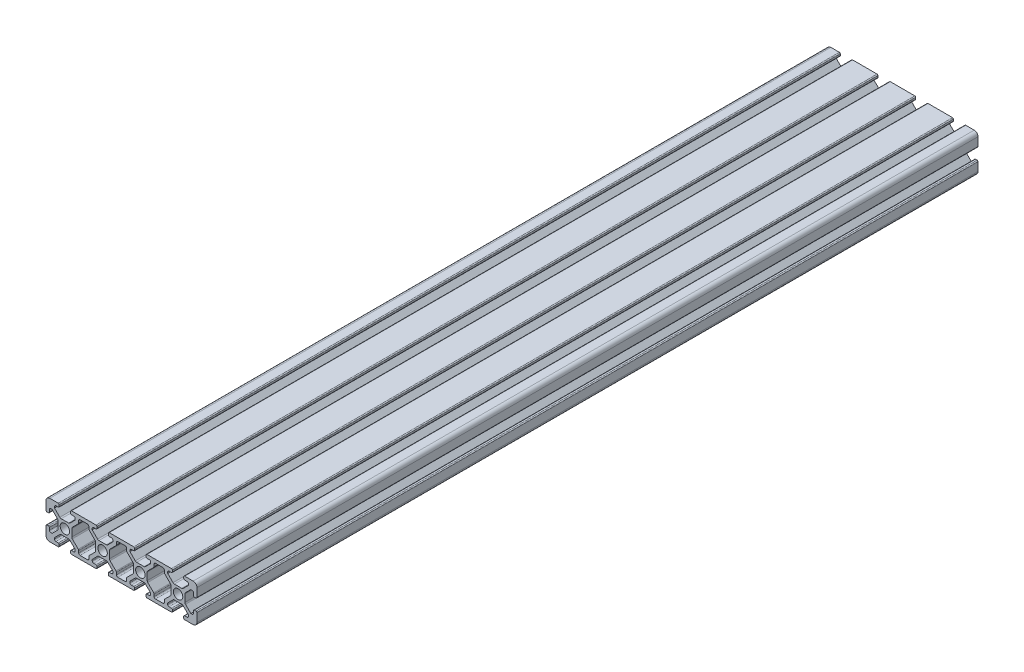
from build123d import *

# Parameters (mm, degrees)
SKETCH1_R           = 2.5
BOSS_EXTRUDE1_DEPTH = 414


with BuildPart() as part:
    # Sketch1 → Boss-Extrude1 (new body)
    with BuildSketch(Plane.XY):
        with BuildLine():
            Line((-41.934956355, 2.341454023), (-37.434956355, 2.341454023))
            ThreePointArc((-37.434956355, 2.341454023), (-37.081402965, 2.487900633), (-36.934956355, 2.841454023))
            Line((-36.934956355, 2.841454023), (-36.934956355, 3.641454023))
            ThreePointArc((-36.934956355, 3.641454023), (-37.081402965, 3.995007414), (-37.434956355, 4.141454023))
            Line((-37.434956355, 4.141454023), (-38.684956355, 4.141454023))
            ThreePointArc((-38.684956355, 4.141454023), (-39.215286441, 4.361123937), (-39.434956355, 4.891454023))
            Line((-39.434956355, 4.891454023), (-39.434956355, 5.568661817))
            Line((-39.434956355, 5.568661817), (-36.605057368, 8.398560804))
            ThreePointArc((-36.605057368, 8.398560804), (-36.280634019, 8.615333556), (-35.897950587, 8.691454023))
            Line((-35.897950587, 8.691454023), (-31.971962124, 8.691454023))
            ThreePointArc((-31.971962124, 8.691454023), (-31.589278691, 8.615333556), (-31.264855343, 8.398560804))
            Line((-31.264855343, 8.398560804), (-28.434956355, 5.568661817))
            Line((-28.434956355, 5.568661817), (-28.434956355, 4.891454023))
            ThreePointArc((-28.434956355, 4.891454023), (-28.654626269, 4.361123937), (-29.184956355, 4.141454023))
            Line((-29.184956355, 4.141454023), (-30.434956355, 4.141454023))
            ThreePointArc((-30.434956355, 4.141454023), (-30.788509746, 3.995007414), (-30.934956355, 3.641454023))
            Line((-30.934956355, 3.641454023), (-30.934956355, 2.841454023))
            ThreePointArc((-30.934956355, 2.841454023), (-30.788509746, 2.487900633), (-30.434956355, 2.341454023))
            Line((-30.434956355, 2.341454023), (-17.434956355, 2.341454023))
            ThreePointArc((-17.434956355, 2.341454023), (-17.081402965, 2.487900633), (-16.934956355, 2.841454023))
            Line((-16.934956355, 2.841454023), (-16.934956355, 3.641454023))
            ThreePointArc((-16.934956355, 3.641454023), (-17.081402965, 3.995007414), (-17.434956355, 4.141454023))
            Line((-17.434956355, 4.141454023), (-18.684956355, 4.141454023))
            ThreePointArc((-18.684956355, 4.141454023), (-19.215286441, 4.361123937), (-19.434956355, 4.891454023))
            Line((-19.434956355, 4.891454023), (-19.434956355, 5.568661817))
            Line((-19.434956355, 5.568661817), (-16.605057368, 8.398560804))
            ThreePointArc((-16.605057368, 8.398560804), (-16.280634019, 8.615333556), (-15.897950587, 8.691454023))
            Line((-15.897950587, 8.691454023), (-11.971962124, 8.691454023))
            ThreePointArc((-11.971962124, 8.691454023), (-11.589278691, 8.615333556), (-11.264855343, 8.398560804))
            Line((-11.264855343, 8.398560804), (-8.434956355, 5.568661817))
            Line((-8.434956355, 5.568661817), (-8.434956355, 4.891454023))
            ThreePointArc((-8.434956355, 4.891454023), (-8.654626269, 4.361123937), (-9.184956355, 4.141454023))
            Line((-9.184956355, 4.141454023), (-10.434956355, 4.141454023))
            ThreePointArc((-10.434956355, 4.141454023), (-10.788509746, 3.995007414), (-10.934956355, 3.641454023))
            Line((-10.934956355, 3.641454023), (-10.934956355, 2.841454023))
            ThreePointArc((-10.934956355, 2.841454023), (-10.788509746, 2.487900633), (-10.434956355, 2.341454023))
            Line((-10.434956355, 2.341454023), (2.565043645, 2.341454023))
            ThreePointArc((2.565043645, 2.341454023), (2.918597035, 2.487900633), (3.065043645, 2.841454023))
            Line((3.065043645, 2.841454023), (3.065043645, 3.641454023))
            ThreePointArc((3.065043645, 3.641454023), (2.918597035, 3.995007414), (2.565043645, 4.141454023))
            Line((2.565043645, 4.141454023), (1.315043645, 4.141454023))
            ThreePointArc((1.315043645, 4.141454023), (0.784713559, 4.361123937), (0.565043645, 4.891454023))
            Line((0.565043645, 4.891454023), (0.565043645, 5.568661817))
            Line((0.565043645, 5.568661817), (3.394942632, 8.398560804))
            ThreePointArc((3.394942632, 8.398560804), (3.719365981, 8.615333556), (4.102049413, 8.691454023))
            Line((4.102049413, 8.691454023), (8.028037876, 8.691454023))
            ThreePointArc((8.028037876, 8.691454023), (8.410721309, 8.615333556), (8.735144657, 8.398560804))
            Line((8.735144657, 8.398560804), (11.565043645, 5.568661817))
            Line((11.565043645, 5.568661817), (11.565043645, 4.891454023))
            ThreePointArc((11.565043645, 4.891454023), (11.345373731, 4.361123937), (10.815043645, 4.141454023))
            Line((10.815043645, 4.141454023), (9.565043645, 4.141454023))
            ThreePointArc((9.565043645, 4.141454023), (9.211490254, 3.995007414), (9.065043645, 3.641454023))
            Line((9.065043645, 3.641454023), (9.065043645, 2.841454023))
            ThreePointArc((9.065043645, 2.841454023), (9.211490254, 2.487900633), (9.565043645, 2.341454023))
            Line((9.565043645, 2.341454023), (22.565043645, 2.341454023))
            ThreePointArc((22.565043645, 2.341454023), (22.918597035, 2.487900633), (23.065043645, 2.841454023))
            Line((23.065043645, 2.841454023), (23.065043645, 3.641454023))
            ThreePointArc((23.065043645, 3.641454023), (22.918597035, 3.995007414), (22.565043645, 4.141454023))
            Line((22.565043645, 4.141454023), (21.315043645, 4.141454023))
            ThreePointArc((21.315043645, 4.141454023), (20.784713559, 4.361123937), (20.565043645, 4.891454023))
            Line((20.565043645, 4.891454023), (20.565043645, 5.568661817))
            Line((20.565043645, 5.568661817), (23.394942632, 8.398560804))
            ThreePointArc((23.394942632, 8.398560804), (23.719365981, 8.615333556), (24.102049413, 8.691454023))
            Line((24.102049413, 8.691454023), (28.028037876, 8.691454023))
            ThreePointArc((28.028037876, 8.691454023), (28.410721309, 8.615333556), (28.735144657, 8.398560804))
            Line((28.735144657, 8.398560804), (31.565043645, 5.568661817))
            Line((31.565043645, 5.568661817), (31.565043645, 4.891454023))
            ThreePointArc((31.565043645, 4.891454023), (31.345373731, 4.361123937), (30.815043645, 4.141454023))
            Line((30.815043645, 4.141454023), (29.565043645, 4.141454023))
            ThreePointArc((29.565043645, 4.141454023), (29.211490254, 3.995007414), (29.065043645, 3.641454023))
            Line((29.065043645, 3.641454023), (29.065043645, 2.841454023))
            ThreePointArc((29.065043645, 2.841454023), (29.211490254, 2.487900633), (29.565043645, 2.341454023))
            Line((29.565043645, 2.341454023), (34.065043645, 2.341454023))
            ThreePointArc((34.065043645, 2.341454023), (35.479257207, 2.927240461), (36.065043645, 4.341454023))
            Line((36.065043645, 4.341454023), (36.065043645, 8.841454023))
            ThreePointArc((36.065043645, 8.841454023), (35.918597035, 9.195007414), (35.565043645, 9.341454023))
            Line((35.565043645, 9.341454023), (34.765043645, 9.341454023))
            ThreePointArc((34.765043645, 9.341454023), (34.411490254, 9.195007414), (34.265043645, 8.841454023))
            Line((34.265043645, 8.841454023), (34.265043645, 7.591454023))
            ThreePointArc((34.265043645, 7.591454023), (34.045373731, 7.061123937), (33.515043645, 6.841454023))
            Line((33.515043645, 6.841454023), (32.837835851, 6.841454023))
            Line((32.837835851, 6.841454023), (30.007936864, 9.671353011))
            ThreePointArc((30.007936864, 9.671353011), (29.791164112, 9.995776359), (29.715043645, 10.378459792))
            Line((29.715043645, 10.378459792), (29.715043645, 14.304448255))
            ThreePointArc((29.715043645, 14.304448255), (29.791164112, 14.687131687), (30.007936864, 15.011555036))
            Line((30.007936864, 15.011555036), (32.837835851, 17.841454023))
            Line((32.837835851, 17.841454023), (33.515043645, 17.841454023))
            ThreePointArc((33.515043645, 17.841454023), (34.045373731, 17.621784109), (34.265043645, 17.091454023))
            Line((34.265043645, 17.091454023), (34.265043645, 15.841454023))
            ThreePointArc((34.265043645, 15.841454023), (34.411490254, 15.487900633), (34.765043645, 15.341454023))
            Line((34.765043645, 15.341454023), (35.565043645, 15.341454023))
            ThreePointArc((35.565043645, 15.341454023), (35.918597035, 15.487900633), (36.065043645, 15.841454023))
            Line((36.065043645, 15.841454023), (36.065043645, 20.341454023))
            ThreePointArc((36.065043645, 20.341454023), (35.479257207, 21.755667586), (34.065043645, 22.341454023))
            Line((34.065043645, 22.341454023), (29.565043645, 22.341454023))
            ThreePointArc((29.565043645, 22.341454023), (29.211490254, 22.195007414), (29.065043645, 21.841454023))
            Line((29.065043645, 21.841454023), (29.065043645, 21.041454023))
            ThreePointArc((29.065043645, 21.041454023), (29.211490254, 20.687900633), (29.565043645, 20.541454023))
            Line((29.565043645, 20.541454023), (30.815043645, 20.541454023))
            ThreePointArc((30.815043645, 20.541454023), (31.345373731, 20.321784109), (31.565043645, 19.791454023))
            Line((31.565043645, 19.791454023), (31.565043645, 19.114246229))
            Line((31.565043645, 19.114246229), (28.735144657, 16.284347242))
            ThreePointArc((28.735144657, 16.284347242), (28.410721309, 16.067574491), (28.028037876, 15.991454023))
            Line((28.028037876, 15.991454023), (24.102049413, 15.991454023))
            ThreePointArc((24.102049413, 15.991454023), (23.719365981, 16.067574491), (23.394942632, 16.284347242))
            Line((23.394942632, 16.284347242), (20.565043645, 19.114246229))
            Line((20.565043645, 19.114246229), (20.565043645, 19.791454023))
            ThreePointArc((20.565043645, 19.791454023), (20.784713559, 20.321784109), (21.315043645, 20.541454023))
            Line((21.315043645, 20.541454023), (22.565043645, 20.541454023))
            ThreePointArc((22.565043645, 20.541454023), (22.918597035, 20.687900633), (23.065043645, 21.041454023))
            Line((23.065043645, 21.041454023), (23.065043645, 21.841454023))
            ThreePointArc((23.065043645, 21.841454023), (22.918597035, 22.195007414), (22.565043645, 22.341454023))
            Line((22.565043645, 22.341454023), (9.565043645, 22.341454023))
            ThreePointArc((9.565043645, 22.341454023), (9.211490254, 22.195007414), (9.065043645, 21.841454023))
            Line((9.065043645, 21.841454023), (9.065043645, 21.041454023))
            ThreePointArc((9.065043645, 21.041454023), (9.211490254, 20.687900633), (9.565043645, 20.541454023))
            Line((9.565043645, 20.541454023), (10.815043645, 20.541454023))
            ThreePointArc((10.815043645, 20.541454023), (11.345373731, 20.321784109), (11.565043645, 19.791454023))
            Line((11.565043645, 19.791454023), (11.565043645, 19.114246229))
            Line((11.565043645, 19.114246229), (8.735144657, 16.284347242))
            ThreePointArc((8.735144657, 16.284347242), (8.410721309, 16.067574491), (8.028037876, 15.991454023))
            Line((8.028037876, 15.991454023), (4.102049413, 15.991454023))
            ThreePointArc((4.102049413, 15.991454023), (3.719365981, 16.067574491), (3.394942632, 16.284347242))
            Line((3.394942632, 16.284347242), (0.565043645, 19.114246229))
            Line((0.565043645, 19.114246229), (0.565043645, 19.791454023))
            ThreePointArc((0.565043645, 19.791454023), (0.784713559, 20.321784109), (1.315043645, 20.541454023))
            Line((1.315043645, 20.541454023), (2.565043645, 20.541454023))
            ThreePointArc((2.565043645, 20.541454023), (2.918597035, 20.687900633), (3.065043645, 21.041454023))
            Line((3.065043645, 21.041454023), (3.065043645, 21.841454023))
            ThreePointArc((3.065043645, 21.841454023), (2.918597035, 22.195007414), (2.565043645, 22.341454023))
            Line((2.565043645, 22.341454023), (-10.434956355, 22.341454023))
            ThreePointArc((-10.434956355, 22.341454023), (-10.788509746, 22.195007414), (-10.934956355, 21.841454023))
            Line((-10.934956355, 21.841454023), (-10.934956355, 21.041454023))
            ThreePointArc((-10.934956355, 21.041454023), (-10.788509746, 20.687900633), (-10.434956355, 20.541454023))
            Line((-10.434956355, 20.541454023), (-9.184956355, 20.541454023))
            ThreePointArc((-9.184956355, 20.541454023), (-8.654626269, 20.321784109), (-8.434956355, 19.791454023))
            Line((-8.434956355, 19.791454023), (-8.434956355, 19.114246229))
            Line((-8.434956355, 19.114246229), (-11.264855343, 16.284347242))
            ThreePointArc((-11.264855343, 16.284347242), (-11.589278691, 16.067574491), (-11.971962124, 15.991454023))
            Line((-11.971962124, 15.991454023), (-15.897950587, 15.991454023))
            ThreePointArc((-15.897950587, 15.991454023), (-16.280634019, 16.067574491), (-16.605057368, 16.284347242))
            Line((-16.605057368, 16.284347242), (-19.434956355, 19.114246229))
            Line((-19.434956355, 19.114246229), (-19.434956355, 19.791454023))
            ThreePointArc((-19.434956355, 19.791454023), (-19.215286441, 20.321784109), (-18.684956355, 20.541454023))
            Line((-18.684956355, 20.541454023), (-17.434956355, 20.541454023))
            ThreePointArc((-17.434956355, 20.541454023), (-17.081402965, 20.687900633), (-16.934956355, 21.041454023))
            Line((-16.934956355, 21.041454023), (-16.934956355, 21.841454023))
            ThreePointArc((-16.934956355, 21.841454023), (-17.081402965, 22.195007414), (-17.434956355, 22.341454023))
            Line((-17.434956355, 22.341454023), (-30.434956355, 22.341454023))
            ThreePointArc((-30.434956355, 22.341454023), (-30.788509746, 22.195007414), (-30.934956355, 21.841454023))
            Line((-30.934956355, 21.841454023), (-30.934956355, 21.041454023))
            ThreePointArc((-30.934956355, 21.041454023), (-30.788509746, 20.687900633), (-30.434956355, 20.541454023))
            Line((-30.434956355, 20.541454023), (-29.184956355, 20.541454023))
            ThreePointArc((-29.184956355, 20.541454023), (-28.654626269, 20.321784109), (-28.434956355, 19.791454023))
            Line((-28.434956355, 19.791454023), (-28.434956355, 19.114246229))
            Line((-28.434956355, 19.114246229), (-31.264855343, 16.284347242))
            ThreePointArc((-31.264855343, 16.284347242), (-31.589278691, 16.067574491), (-31.971962124, 15.991454023))
            Line((-31.971962124, 15.991454023), (-35.897950587, 15.991454023))
            ThreePointArc((-35.897950587, 15.991454023), (-36.280634019, 16.067574491), (-36.605057368, 16.284347242))
            Line((-36.605057368, 16.284347242), (-39.434956355, 19.114246229))
            Line((-39.434956355, 19.114246229), (-39.434956355, 19.791454023))
            ThreePointArc((-39.434956355, 19.791454023), (-39.215286441, 20.321784109), (-38.684956355, 20.541454023))
            Line((-38.684956355, 20.541454023), (-37.434956355, 20.541454023))
            ThreePointArc((-37.434956355, 20.541454023), (-37.081402965, 20.687900633), (-36.934956355, 21.041454023))
            Line((-36.934956355, 21.041454023), (-36.934956355, 21.841454023))
            ThreePointArc((-36.934956355, 21.841454023), (-37.081402965, 22.195007414), (-37.434956355, 22.341454023))
            Line((-37.434956355, 22.341454023), (-41.934956355, 22.341454023))
            ThreePointArc((-41.934956355, 22.341454023), (-43.349169918, 21.755667586), (-43.934956355, 20.341454023))
            Line((-43.934956355, 20.341454023), (-43.934956355, 15.841454023))
            ThreePointArc((-43.934956355, 15.841454023), (-43.788509746, 15.487900633), (-43.434956355, 15.341454023))
            Line((-43.434956355, 15.341454023), (-42.634956355, 15.341454023))
            ThreePointArc((-42.634956355, 15.341454023), (-42.281402965, 15.487900633), (-42.134956355, 15.841454023))
            Line((-42.134956355, 15.841454023), (-42.134956355, 17.091454023))
            ThreePointArc((-42.134956355, 17.091454023), (-41.915286441, 17.621784109), (-41.384956355, 17.841454023))
            Line((-41.384956355, 17.841454023), (-40.707748561, 17.841454023))
            Line((-40.707748561, 17.841454023), (-37.877849574, 15.011555036))
            ThreePointArc((-37.877849574, 15.011555036), (-37.661076823, 14.687131687), (-37.584956355, 14.304448255))
            Line((-37.584956355, 14.304448255), (-37.584956355, 10.378459792))
            ThreePointArc((-37.584956355, 10.378459792), (-37.661076823, 9.995776359), (-37.877849574, 9.671353011))
            Line((-37.877849574, 9.671353011), (-40.707748561, 6.841454023))
            Line((-40.707748561, 6.841454023), (-41.384956355, 6.841454023))
            ThreePointArc((-41.384956355, 6.841454023), (-41.915286441, 7.061123937), (-42.134956355, 7.591454023))
            Line((-42.134956355, 7.591454023), (-42.134956355, 8.841454023))
            ThreePointArc((-42.134956355, 8.841454023), (-42.281402965, 9.195007414), (-42.634956355, 9.341454023))
            Line((-42.634956355, 9.341454023), (-43.434956355, 9.341454023))
            ThreePointArc((-43.434956355, 9.341454023), (-43.788509746, 9.195007414), (-43.934956355, 8.841454023))
            Line((-43.934956355, 8.841454023), (-43.934956355, 4.341454023))
            ThreePointArc((-43.934956355, 4.341454023), (-43.349169918, 2.927240461), (-41.934956355, 2.341454023))
        make_face()
        with Locations((-33.934956355, 12.341454023)):
            Circle(SKETCH1_R, mode=Mode.SUBTRACT)
        with Locations((-13.934956355, 12.341454023)):
            Circle(SKETCH1_R, mode=Mode.SUBTRACT)
        with Locations((6.065043645, 12.341454023)):
            Circle(SKETCH1_R, mode=Mode.SUBTRACT)
        with Locations((26.065043645, 12.341454023)):
            Circle(SKETCH1_R, mode=Mode.SUBTRACT)
        with BuildLine():
            Line((-9.992063136, 15.011555036), (-6.854626269, 18.148991903))
            ThreePointArc((-6.854626269, 18.148991903), (-6.692046706, 18.392309415), (-6.634956355, 18.679321989))
            Line((-6.634956355, 18.679321989), (-6.634956355, 19.791454023))
            ThreePointArc((-6.634956355, 19.791454023), (-6.415286441, 20.321784109), (-5.884956355, 20.541454023))
            Line((-5.884956355, 20.541454023), (-1.984956355, 20.541454023))
            ThreePointArc((-1.984956355, 20.541454023), (-1.454626269, 20.321784109), (-1.234956355, 19.791454023))
            Line((-1.234956355, 19.791454023), (-1.234956355, 18.679321989))
            ThreePointArc((-1.234956355, 18.679321989), (-1.177866005, 18.392309415), (-1.015286441, 18.148991903))
            Line((-1.015286441, 18.148991903), (2.122150426, 15.011555036))
            ThreePointArc((2.122150426, 15.011555036), (2.338923177, 14.687131687), (2.415043645, 14.304448255))
            Line((2.415043645, 14.304448255), (2.415043645, 10.378459792))
            ThreePointArc((2.415043645, 10.378459792), (2.338923177, 9.995776359), (2.122150426, 9.671353011))
            Line((2.122150426, 9.671353011), (-1.015286441, 6.533916144))
            ThreePointArc((-1.015286441, 6.533916144), (-1.177866005, 6.290598632), (-1.234956355, 6.003586058))
            Line((-1.234956355, 6.003586058), (-1.234956355, 4.891454023))
            ThreePointArc((-1.234956355, 4.891454023), (-1.454626269, 4.361123937), (-1.984956355, 4.141454023))
            Line((-1.984956355, 4.141454023), (-5.884956355, 4.141454023))
            ThreePointArc((-5.884956355, 4.141454023), (-6.415286441, 4.361123937), (-6.634956355, 4.891454023))
            Line((-6.634956355, 4.891454023), (-6.634956355, 6.003586058))
            ThreePointArc((-6.634956355, 6.003586058), (-6.692046706, 6.290598632), (-6.854626269, 6.533916144))
            Line((-6.854626269, 6.533916144), (-9.992063136, 9.671353011))
            ThreePointArc((-9.992063136, 9.671353011), (-10.208835888, 9.995776359), (-10.284956355, 10.378459792))
            Line((-10.284956355, 10.378459792), (-10.284956355, 14.304448255))
            ThreePointArc((-10.284956355, 14.304448255), (-10.208835888, 14.687131687), (-9.992063136, 15.011555036))
        make_face(mode=Mode.SUBTRACT)
        with BuildLine():
            Line((-21.015286441, 18.148991903), (-17.877849574, 15.011555036))
            ThreePointArc((-17.877849574, 15.011555036), (-17.661076823, 14.687131687), (-17.584956355, 14.304448255))
            Line((-17.584956355, 14.304448255), (-17.584956355, 10.378459792))
            ThreePointArc((-17.584956355, 10.378459792), (-17.661076823, 9.995776359), (-17.877849574, 9.671353011))
            Line((-17.877849574, 9.671353011), (-21.015286441, 6.533916144))
            ThreePointArc((-21.015286441, 6.533916144), (-21.177866005, 6.290598632), (-21.234956355, 6.003586058))
            Line((-21.234956355, 6.003586058), (-21.234956355, 4.891454023))
            ThreePointArc((-21.234956355, 4.891454023), (-21.454626269, 4.361123937), (-21.984956355, 4.141454023))
            Line((-21.984956355, 4.141454023), (-25.884956355, 4.141454023))
            ThreePointArc((-25.884956355, 4.141454023), (-26.415286441, 4.361123937), (-26.634956355, 4.891454023))
            Line((-26.634956355, 4.891454023), (-26.634956355, 6.003586058))
            ThreePointArc((-26.634956355, 6.003586058), (-26.692046706, 6.290598632), (-26.854626269, 6.533916144))
            Line((-26.854626269, 6.533916144), (-29.992063136, 9.671353011))
            ThreePointArc((-29.992063136, 9.671353011), (-30.208835888, 9.995776359), (-30.284956355, 10.378459792))
            Line((-30.284956355, 10.378459792), (-30.284956355, 14.304448255))
            ThreePointArc((-30.284956355, 14.304448255), (-30.208835888, 14.687131687), (-29.992063136, 15.011555036))
            Line((-29.992063136, 15.011555036), (-26.854626269, 18.148991903))
            ThreePointArc((-26.854626269, 18.148991903), (-26.692046706, 18.392309415), (-26.634956355, 18.679321989))
            Line((-26.634956355, 18.679321989), (-26.634956355, 19.791454023))
            ThreePointArc((-26.634956355, 19.791454023), (-26.415286441, 20.321784109), (-25.884956355, 20.541454023))
            Line((-25.884956355, 20.541454023), (-21.984956355, 20.541454023))
            ThreePointArc((-21.984956355, 20.541454023), (-21.454626269, 20.321784109), (-21.234956355, 19.791454023))
            Line((-21.234956355, 19.791454023), (-21.234956355, 18.679321989))
            ThreePointArc((-21.234956355, 18.679321989), (-21.177866005, 18.392309415), (-21.015286441, 18.148991903))
        make_face(mode=Mode.SUBTRACT)
        with BuildLine():
            Line((18.984713559, 18.148991903), (22.122150426, 15.011555036))
            ThreePointArc((22.122150426, 15.011555036), (22.338923177, 14.687131687), (22.415043645, 14.304448255))
            Line((22.415043645, 14.304448255), (22.415043645, 10.378459792))
            ThreePointArc((22.415043645, 10.378459792), (22.338923177, 9.995776359), (22.122150426, 9.671353011))
            Line((22.122150426, 9.671353011), (18.984713559, 6.533916144))
            ThreePointArc((18.984713559, 6.533916144), (18.822133995, 6.290598632), (18.765043645, 6.003586058))
            Line((18.765043645, 6.003586058), (18.765043645, 4.891454023))
            ThreePointArc((18.765043645, 4.891454023), (18.545373731, 4.361123937), (18.015043645, 4.141454023))
            Line((18.015043645, 4.141454023), (14.115043645, 4.141454023))
            ThreePointArc((14.115043645, 4.141454023), (13.584713559, 4.361123937), (13.365043645, 4.891454023))
            Line((13.365043645, 4.891454023), (13.365043645, 6.003586058))
            ThreePointArc((13.365043645, 6.003586058), (13.307953294, 6.290598632), (13.145373731, 6.533916144))
            Line((13.145373731, 6.533916144), (10.007936864, 9.671353011))
            ThreePointArc((10.007936864, 9.671353011), (9.791164112, 9.995776359), (9.715043645, 10.378459792))
            Line((9.715043645, 10.378459792), (9.715043645, 14.304448255))
            ThreePointArc((9.715043645, 14.304448255), (9.791164112, 14.687131687), (10.007936864, 15.011555036))
            Line((10.007936864, 15.011555036), (13.145373731, 18.148991903))
            ThreePointArc((13.145373731, 18.148991903), (13.307953294, 18.392309415), (13.365043645, 18.679321989))
            Line((13.365043645, 18.679321989), (13.365043645, 19.791454023))
            ThreePointArc((13.365043645, 19.791454023), (13.584713559, 20.321784109), (14.115043645, 20.541454023))
            Line((14.115043645, 20.541454023), (18.015043645, 20.541454023))
            ThreePointArc((18.015043645, 20.541454023), (18.545373731, 20.321784109), (18.765043645, 19.791454023))
            Line((18.765043645, 19.791454023), (18.765043645, 18.679321989))
            ThreePointArc((18.765043645, 18.679321989), (18.822133995, 18.392309415), (18.984713559, 18.148991903))
        make_face(mode=Mode.SUBTRACT)
    extrude(amount=BOSS_EXTRUDE1_DEPTH)


solid = part.part
